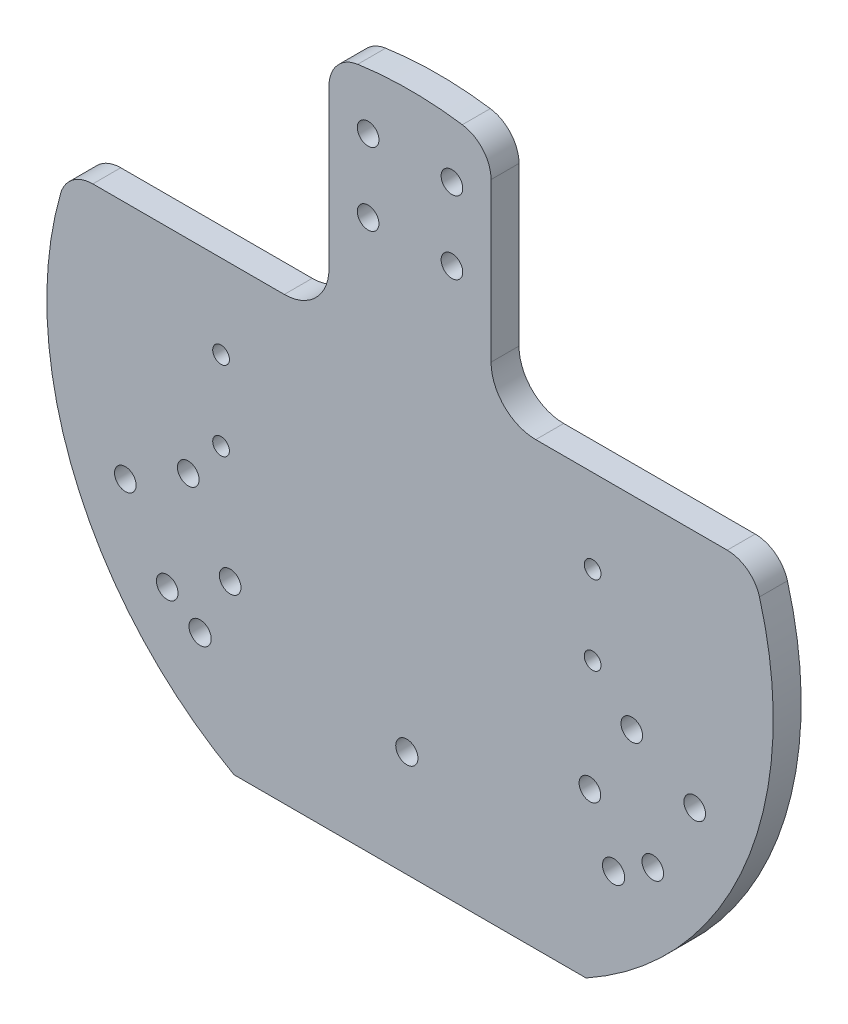
from build123d import *

# Parameters (mm, degrees)
SKETCH1_R                                         = 82.55
BASE_DEPTH                                        = 6.35
CSK_FOR_6_FLAT_HEAD_MACHINE_SCREW_100_D           = 3.7973
CSK_FOR_6_FLAT_HEAD_MACHINE_SCREW_100_CSINK_D     = 7.0866
CSK_FOR_6_FLAT_HEAD_MACHINE_SCREW_100_CSINK_ANGLE = 100
CUT_EXTRUDE1_DEPTH                                = 117.915899261
F_10_0_1935_DIAMETER_HOLE1_AT_2_COUNT             = 2
F_10_0_1935_DIAMETER_HOLE1_AT_2_PITCH             = 19.05
F_10_0_1935_DIAMETER_HOLE1_AT_3_COUNT             = 2
F_10_0_1935_DIAMETER_HOLE1_AT_3_PITCH             = 25.208780216
F_10_0_1935_DIAMETER_HOLE1_AT_4_COUNT             = 2
F_10_0_1935_DIAMETER_HOLE1_AT_4_PITCH             = 16.51
CIRPATTERN1_COUNT                                 = 3
CUT_EXTRUDE3_DEPTH                                = 117.915899261
FILLET1_R                                         = 7.62
F_8_0_199_DIAMETER_HOLE1_D                        = 5.0546


with BuildPart() as part:
    # Sketch1 → Base (new body)
    with BuildSketch(Plane.XY):
        Circle(SKETCH1_R)
    extrude(amount=BASE_DEPTH)

    # CSK for _6 Flat Head Machine Screw _100 (through all)
    with Locations(Plane(origin=(0, 0, 0), x_dir=(-1, 0, 0), z_dir=(0, 0, -1))):
        with Locations((-41.5, 9), (-41.5, -9), (42.95, 9), (42.95, -9)):
            CounterSinkHole(CSK_FOR_6_FLAT_HEAD_MACHINE_SCREW_100_D / 2, CSK_FOR_6_FLAT_HEAD_MACHINE_SCREW_100_CSINK_D / 2, counter_sink_angle=CSK_FOR_6_FLAT_HEAD_MACHINE_SCREW_100_CSINK_ANGLE)

    # Sketch8 → Cut-Extrude1 (cut, through all)
    with BuildSketch(Plane(origin=(0, 0, 0), x_dir=(-1, 0, 0), z_dir=(0, 0, -1))):
        with BuildLine():
            Line((40, -72.21151224), (-40, -72.21151224))
            ThreePointArc((-40, -72.21151224), (0, -82.55), (40, -72.21151224))
        make_face()
    extrude(amount=-CUT_EXTRUDE1_DEPTH, mode=Mode.SUBTRACT)

    # Sketch12 → #10 (0.1935) Diameter Hole1 (revolve, cut)
    with BuildSketch(Plane(origin=(-40.881368906, -34.601391971, 0), x_dir=(0, 1, 0), z_dir=(1, 0, 0))):
        Polygon((0, 0), (0, 7.826584928), (2.45745, 6.35), (2.45745, 0), align=None)
    f_10_0_1935_diameter_hole1 = revolve(axis=Axis((-40.881368906, -34.601391971, -6.35), (0, 0, 1)), mode=Mode.SUBTRACT)

    # #10 (0.1935) Diameter Hole1 at 2: #10 (0.1935) Diameter Hole1 ×2
    with Locations(*[Vector(-0.4999999999999995, 0.866025403784439, 0) * (i * F_10_0_1935_DIAMETER_HOLE1_AT_2_PITCH) for i in range(1, F_10_0_1935_DIAMETER_HOLE1_AT_2_COUNT)]):
        add(f_10_0_1935_diameter_hole1, mode=Mode.SUBTRACT)

    # #10 (0.1935) Diameter Hole1 at 3: #10 (0.1935) Diameter Hole1 ×2
    with Locations(*[Vector(-0.9450310253789799, 0.32698067384962365, 0) * (i * F_10_0_1935_DIAMETER_HOLE1_AT_3_PITCH) for i in range(1, F_10_0_1935_DIAMETER_HOLE1_AT_3_COUNT)]):
        add(f_10_0_1935_diameter_hole1, mode=Mode.SUBTRACT)

    # #10 (0.1935) Diameter Hole1 at 4: #10 (0.1935) Diameter Hole1 ×2
    with Locations(*[Vector(-0.8660254037844388, -0.49999999999999967, 0) * (i * F_10_0_1935_DIAMETER_HOLE1_AT_4_PITCH) for i in range(1, F_10_0_1935_DIAMETER_HOLE1_AT_4_COUNT)]):
        add(f_10_0_1935_diameter_hole1, mode=Mode.SUBTRACT)

    # CirPattern1: #10 (0.1935) Diameter Hole1 ×3 about axis
    cirpattern1_axis = Axis((0, 0, 0), (0, 0, 1))
    for i in range(1, CIRPATTERN1_COUNT):
        add(f_10_0_1935_diameter_hole1.rotate(cirpattern1_axis, i * 360 / CIRPATTERN1_COUNT), mode=Mode.SUBTRACT)

    # CirPattern1 copy 1 sketch → CirPattern1 copy 1 (revolve, cut)
    with BuildSketch(Plane(origin=(40.881368906, -34.601391971, 0), x_dir=(-0.8660254037844387, -0.4999999999999998, 0), z_dir=(-0.4999999999999998, 0.8660254037844387, 0))):
        Polygon((0, 0), (0, 7.826584928), (2.45745, 6.35), (2.45745, 0), align=None)
    revolve(axis=Axis((40.881368906, -34.601391971, -6.35), (0, 0, 1)), mode=Mode.SUBTRACT)

    # CirPattern1 copy 2 sketch → CirPattern1 copy 2 (revolve, cut)
    with BuildSketch(Plane(origin=(9.525, 52.705, 0), x_dir=(0.8660254037844384, -0.5000000000000004, 0), z_dir=(-0.5000000000000004, -0.8660254037844384, 0))):
        Polygon((0, 0), (0, 7.826584928), (2.45745, 6.35), (2.45745, 0), align=None)
    revolve(axis=Axis((9.525, 52.705, -6.35), (0, 0, 1)), mode=Mode.SUBTRACT)

    # CirPattern1 copy 3 sketch → CirPattern1 copy 3 (revolve, cut)
    with BuildSketch(Plane(origin=(55.179448323, -42.856391971, 0), x_dir=(-0.8660254037844387, -0.4999999999999998, 0), z_dir=(-0.4999999999999998, 0.8660254037844387, 0))):
        Polygon((0, 0), (0, 7.826584928), (2.45745, 6.35), (2.45745, 0), align=None)
    revolve(axis=Axis((55.179448323, -42.856391971, -6.35), (0, 0, 1)), mode=Mode.SUBTRACT)

    # CirPattern1 copy 4 sketch → CirPattern1 copy 4 (revolve, cut)
    with BuildSketch(Plane(origin=(9.525, 69.215, 0), x_dir=(0.8660254037844384, -0.5000000000000004, 0), z_dir=(-0.5000000000000004, -0.8660254037844384, 0))):
        Polygon((0, 0), (0, 7.826584928), (2.45745, 6.35), (2.45745, 0), align=None)
    revolve(axis=Axis((9.525, 69.215, -6.35), (0, 0, 1)), mode=Mode.SUBTRACT)

    # CirPattern1 copy 5 sketch → CirPattern1 copy 5 (revolve, cut)
    with BuildSketch(Plane(origin=(64.704448323, -26.358608029, 0), x_dir=(-0.8660254037844387, -0.4999999999999998, 0), z_dir=(-0.4999999999999998, 0.8660254037844387, 0))):
        Polygon((0, 0), (0, 7.826584928), (2.45745, 6.35), (2.45745, 0), align=None)
    revolve(axis=Axis((64.704448323, -26.358608029, -6.35), (0, 0, 1)), mode=Mode.SUBTRACT)

    # CirPattern1 copy 6 sketch → CirPattern1 copy 6 (revolve, cut)
    with BuildSketch(Plane(origin=(-9.525, 69.215, 0), x_dir=(0.8660254037844384, -0.5000000000000004, 0), z_dir=(-0.5000000000000004, -0.8660254037844384, 0))):
        Polygon((0, 0), (0, 7.826584928), (2.45745, 6.35), (2.45745, 0), align=None)
    revolve(axis=Axis((-9.525, 69.215, -6.35), (0, 0, 1)), mode=Mode.SUBTRACT)

    # Sketch14 → Cut-Extrude3 (cut, through all)
    with BuildSketch(Plane.XY.offset(6.35)):
        with BuildLine():
            Line((-28.575, 28.05), (-123.194399556, 28.05))
            Line((-123.194399556, 28.05), (-123.194399556, 124.921419199))
            Line((-123.194399556, 124.921419199), (-18.415, 124.921419199))
            Line((-18.415, 124.921419199), (-18.415, 38.21))
            ThreePointArc((-18.415, 38.21), (-21.390795103, 31.025795103), (-28.575, 28.05))
        make_face()
        with BuildLine():
            Line((123.194399556, 28.05), (123.194399556, 124.921419199))
            Line((123.194399556, 124.921419199), (18.415, 124.921419199))
            Line((18.415, 124.921419199), (18.415, 38.21))
            ThreePointArc((18.415, 38.21), (21.390795103, 31.025795103), (28.575, 28.05))
            Line((28.575, 28.05), (123.194399556, 28.05))
        make_face()
    extrude(amount=-CUT_EXTRUDE3_DEPTH, mode=Mode.SUBTRACT)

    # Fillet1
    fillet1_edges = [part.edges().sort_by_distance(p)[0] for p in [
        (-18.415, 80.469809711, 3.175),
        (-77.638263762, 28.05, 3.175),
        (18.415, 80.469809711, 3.175),
        (77.638263762, 28.05, 3.175),
    ]]
    fillet(fillet1_edges, radius=FILLET1_R)

    # #8 (0.199) Diameter Hole1 (through all)
    with Locations(Plane(origin=(0, 0, 0), x_dir=(-1, 0, 0), z_dir=(0, 0, -1))):
        with Locations((47.715, -48.08151224), (0.725, -48.08151224), (-46.265, -48.08151224)):
            Hole(F_8_0_199_DIAMETER_HOLE1_D / 2)


solid = part.part
